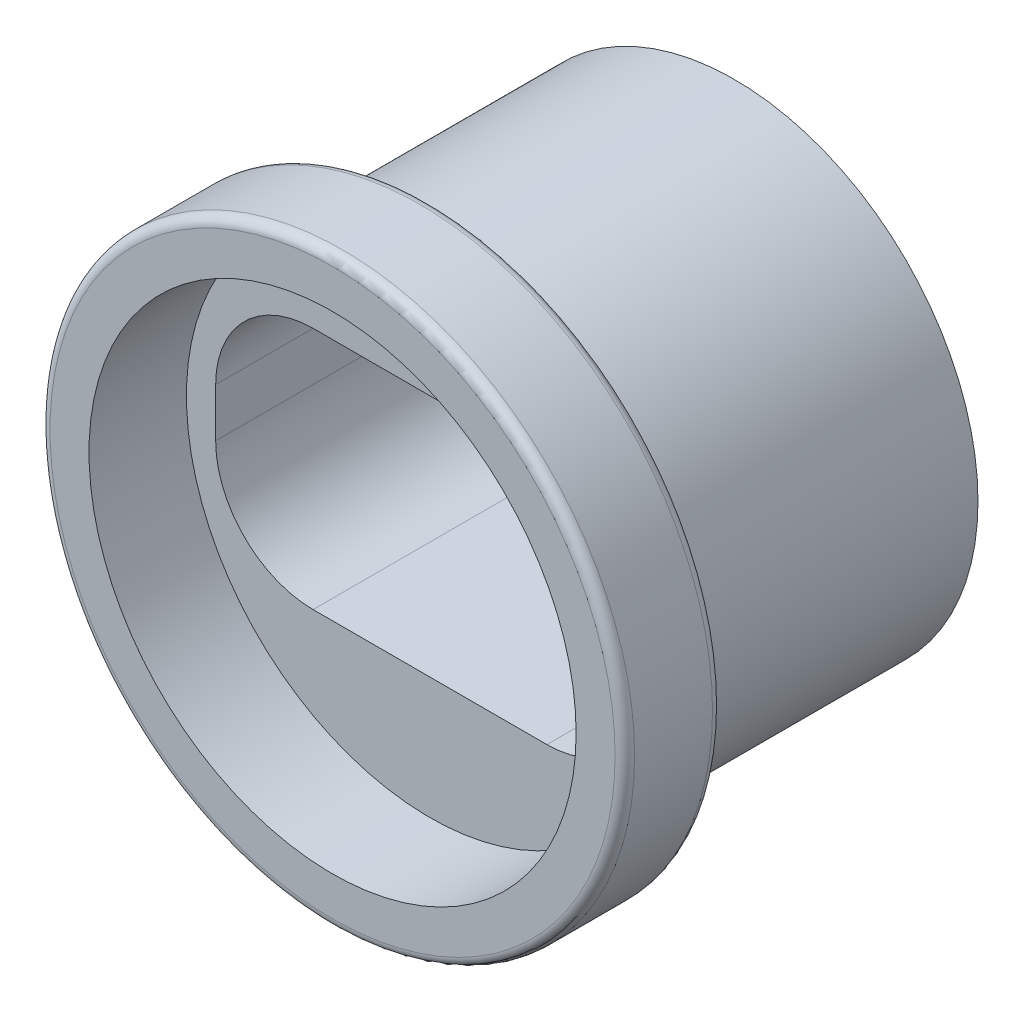
from build123d import *

# Parameters (mm, degrees)
SKETCH1_R           = 6.35
BOSS_EXTRUDE1_DEPTH = 7.9375
SKETCH2_R           = 7.62
SKETCH2_R_2         = 6.35
BOSS_EXTRUDE2_DEPTH = 2.54
FILLET1_R           = 0.254


with BuildPart() as part:
    # Sketch1 → Boss-Extrude1 (new body)
    with BuildSketch(Plane.XY):
        Circle(SKETCH1_R)
        with BuildLine():
            Line((3.048, -3.175), (-3.048, -3.175))
            ThreePointArc((-3.048, -3.175), (-4.844051224, -2.431051224), (-5.588, -0.635))
            Line((-5.588, -0.635), (-5.588, 0.635))
            ThreePointArc((-5.588, 0.635), (-4.844051224, 2.431051224), (-3.048, 3.175))
            Line((-3.048, 3.175), (3.048, 3.175))
            ThreePointArc((3.048, 3.175), (4.844051224, 2.431051224), (5.588, 0.635))
            Line((5.588, 0.635), (5.588, -0.635))
            ThreePointArc((5.588, -0.635), (4.844051224, -2.431051224), (3.048, -3.175))
        make_face(mode=Mode.SUBTRACT)
    extrude(amount=BOSS_EXTRUDE1_DEPTH)


with BuildPart() as body_2:
    # Sketch2 → Boss-Extrude2 (new body)
    with BuildSketch(Plane.XY.offset(7.9375)):
        Circle(SKETCH2_R)
        Circle(SKETCH2_R_2, mode=Mode.SUBTRACT)
    extrude(amount=BOSS_EXTRUDE2_DEPTH)

    # Fillet1
    fillet1_edges = [body_2.edges().sort_by_distance(p)[0] for p in [
        (-7.62, 0, 7.9375),
        (-7.62, 0, 10.4775),
    ]]
    fillet(fillet1_edges, radius=FILLET1_R)


solid = Compound([part.part, body_2.part])
